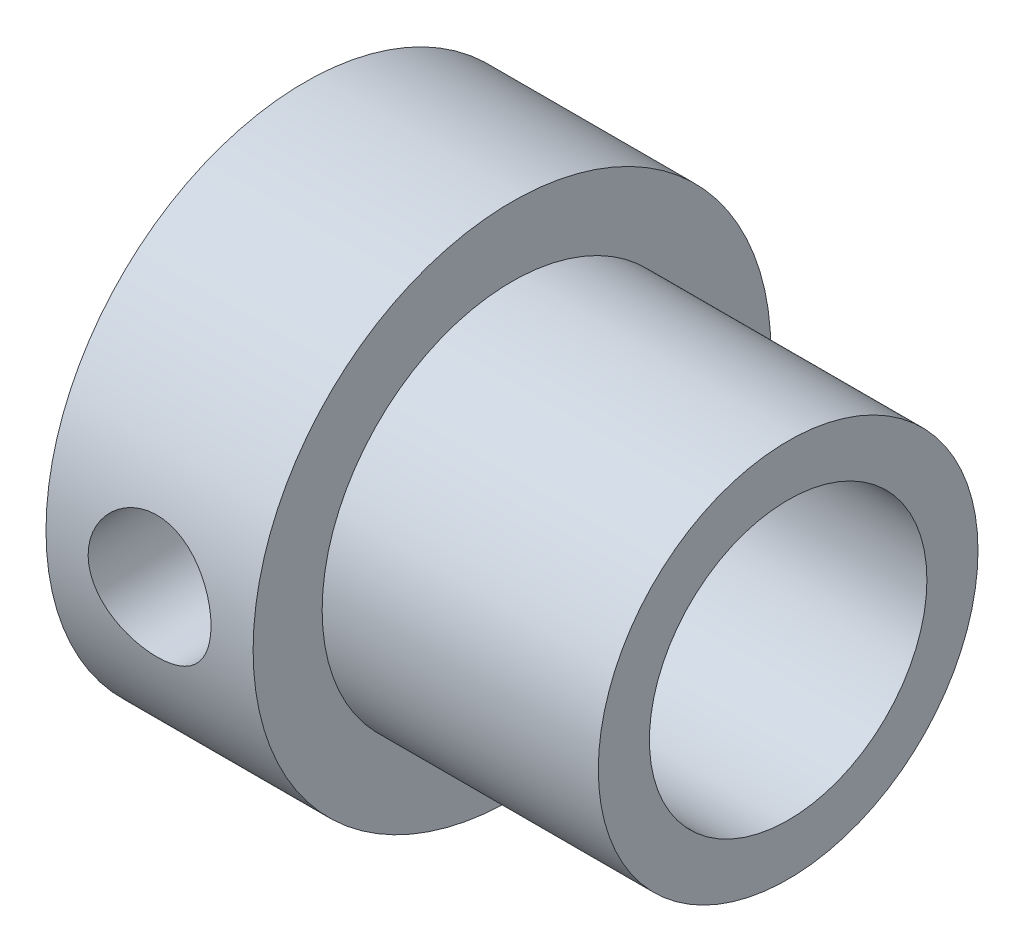
from build123d import *

# Parameters (mm, degrees)
SKETCH1_R               = 4.7625
SKETCH1_R_2             = 2.5527
BOSS_EXTRUDE1_DEPTH     = 8.89
SKETCH2_W               = 5.08
SKETCH2_H               = 1.27
CUT_EXTRUDE1_DEPTH      = 12.153246725
CUT_EXTRUDE1_DEPTH_BACK = 12.153246725
SKETCH7_R               = 0.396875
SKETCH3_W               = 1.1303
SKETCH3_H               = 4.7625


with BuildPart() as part:
    # Sketch1 → Boss-Extrude1 (new body)
    with BuildSketch(Plane(origin=(0, 0, 0), x_dir=(0, 0, -1), z_dir=(1, 0, 0))):
        Circle(SKETCH1_R)
        Circle(SKETCH1_R_2, mode=Mode.SUBTRACT)
    extrude(amount=BOSS_EXTRUDE1_DEPTH)

    # Sketch2 → Cut-Revolve1 (revolve, cut)
    with BuildSketch(Plane.XY, mode=Mode.PRIVATE) as cut_revolve1_sk:
        with Locations((6.35, 4.1275)):
            Rectangle(SKETCH2_W, SKETCH2_H)
    revolve(cut_revolve1_sk.sketch.rotate(Axis((8.89, 0, 0), (-1, 0, 0)), 90), axis=Axis((8.89, 0, 0), (-1, 0, 0)), mode=Mode.SUBTRACT)

    # Sketch7 → Cut-Extrude1 (cut, two sides: drawn at the far end of the back side and taken through both)
    with BuildSketch(Plane(origin=(0, 0, 0), x_dir=(1, 0, 0), z_dir=(0, 1, 0)).offset(-CUT_EXTRUDE1_DEPTH_BACK)):
        with Locations(Location((1.905, 3.81, 0), (0, 0, 270))):
            Circle(SKETCH7_R)
    extrude(amount=CUT_EXTRUDE1_DEPTH + CUT_EXTRUDE1_DEPTH_BACK, mode=Mode.SUBTRACT)

    # Sketch3 → ShaftSetScrew (revolve, cut)
    with BuildSketch(Plane.YZ.offset(1.905)):
        with Locations((0.56515, 2.38125)):
            Rectangle(SKETCH3_W, SKETCH3_H)
    revolve(axis=Axis((1.905, 0, -6.35), (0, 0, 1)), mode=Mode.SUBTRACT)


solid = part.part
